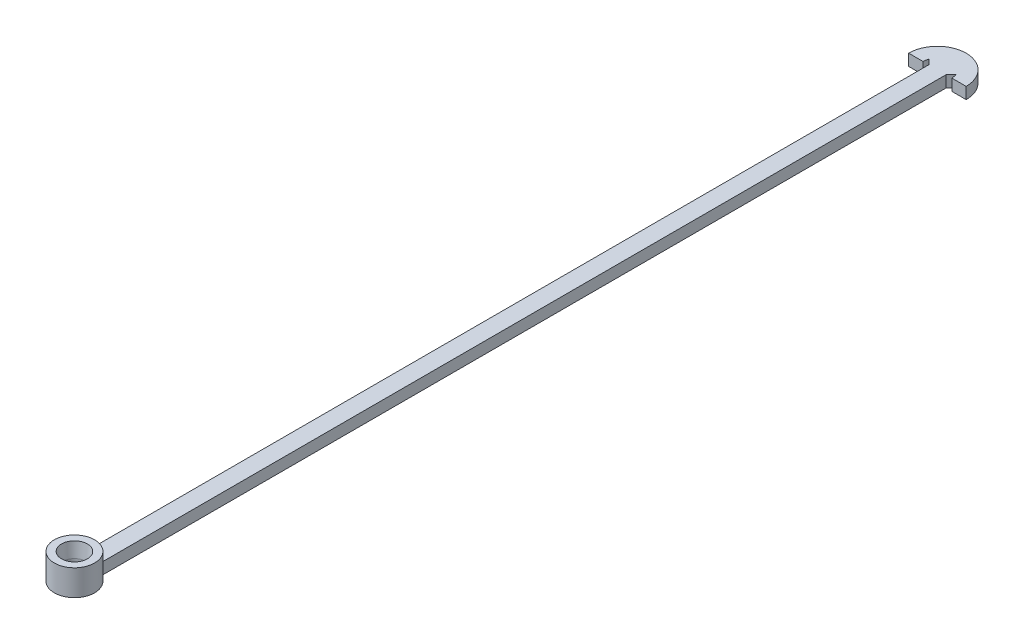
from build123d import *

# Parameters (mm, degrees)
SKETCH1_R           = 4
BOSS_EXTRUDE1_DEPTH = 4
SKETCH4_R           = 7
BOSS_EXTRUDE2_DEPTH = 5
SKETCH2_R           = 4.5
SKETCH3_R           = 4


with BuildPart() as part:
    # Sketch1 → Boss-Extrude1 (new body)
    with BuildSketch(Plane(origin=(0, 0, 0), x_dir=(1, 0, 0), z_dir=(0, 1, 0))):
        with BuildLine():
            Line((-3, 300), (-3, 6.32455532))
            ThreePointArc((-3, 6.32455532), (0, -7), (3, 6.32455532))
            Line((3, 6.32455532), (3, 300))
            Line((3, 300), (4.701562119, 301.701562119))
            ThreePointArc((4.701562119, 301.701562119), (4.924825408, 300.863767737), (5, 300))
            Line((5, 300), (10, 300))
            ThreePointArc((10, 300), (0, 310), (-10, 300))
            Line((-10, 300), (-5, 300))
            ThreePointArc((-5, 300), (-4.924825408, 300.863767737), (-4.701562119, 301.701562119))
            Line((-4.701562119, 301.701562119), (-3, 300))
        make_face()
        with Locations(Location((0, 0, 0), (0, 0, 270))):
            Circle(SKETCH1_R, mode=Mode.SUBTRACT)
    extrude(amount=BOSS_EXTRUDE1_DEPTH)

    # Sketch4 → Boss-Extrude2 (add)
    with BuildSketch(Plane(origin=(0, 4, 0), x_dir=(1, 0, 0), z_dir=(0, 1, 0))):
        with Locations(Location((0, 0, 0), (0, 0, 64.623066475))):
            Circle(SKETCH4_R)
    extrude(amount=BOSS_EXTRUDE2_DEPTH)

    # Sketch2 → Cut-Loft1 section 0
    with BuildSketch(Plane(origin=(0, 9, 0), x_dir=(1, 0, 0), z_dir=(0, 1, 0))):
        Circle(SKETCH2_R)
    # Sketch3 → Cut-Loft1 section 1
    with BuildSketch(Plane(origin=(0, 4, 0), x_dir=(1, 0, 0), z_dir=(0, 1, 0))):
        Circle(SKETCH3_R)
    loft(mode=Mode.SUBTRACT)


solid = part.part
